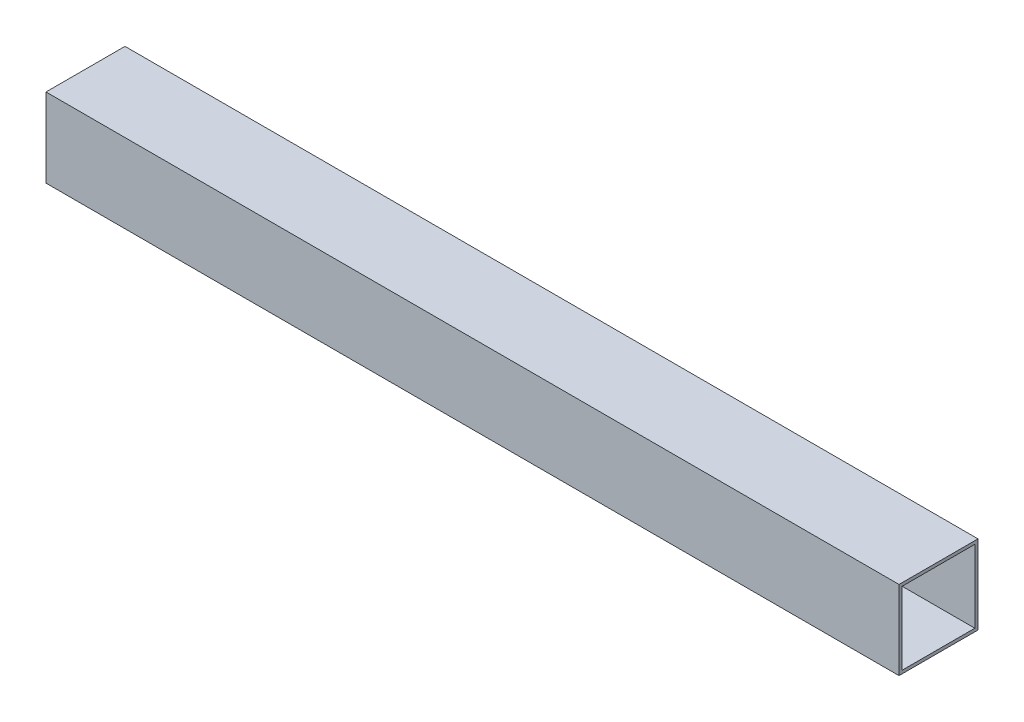
from build123d import *

# Parameters (mm, degrees)
SKETCH2_W           = 25
SKETCH2_H           = 25
SKETCH2_W_2         = 23
SKETCH2_H_2         = 23
BOSS_EXTRUDE1_DEPTH = 270


with BuildPart() as part:
    # Sketch2 → Boss-Extrude1 (new body)
    with BuildSketch(Plane(origin=(0, 0, 0), x_dir=(0, 0, -1), z_dir=(1, 0, 0))):
        Rectangle(SKETCH2_W, SKETCH2_H)
        Rectangle(SKETCH2_W_2, SKETCH2_H_2, mode=Mode.SUBTRACT)
    extrude(amount=BOSS_EXTRUDE1_DEPTH)


solid = part.part
